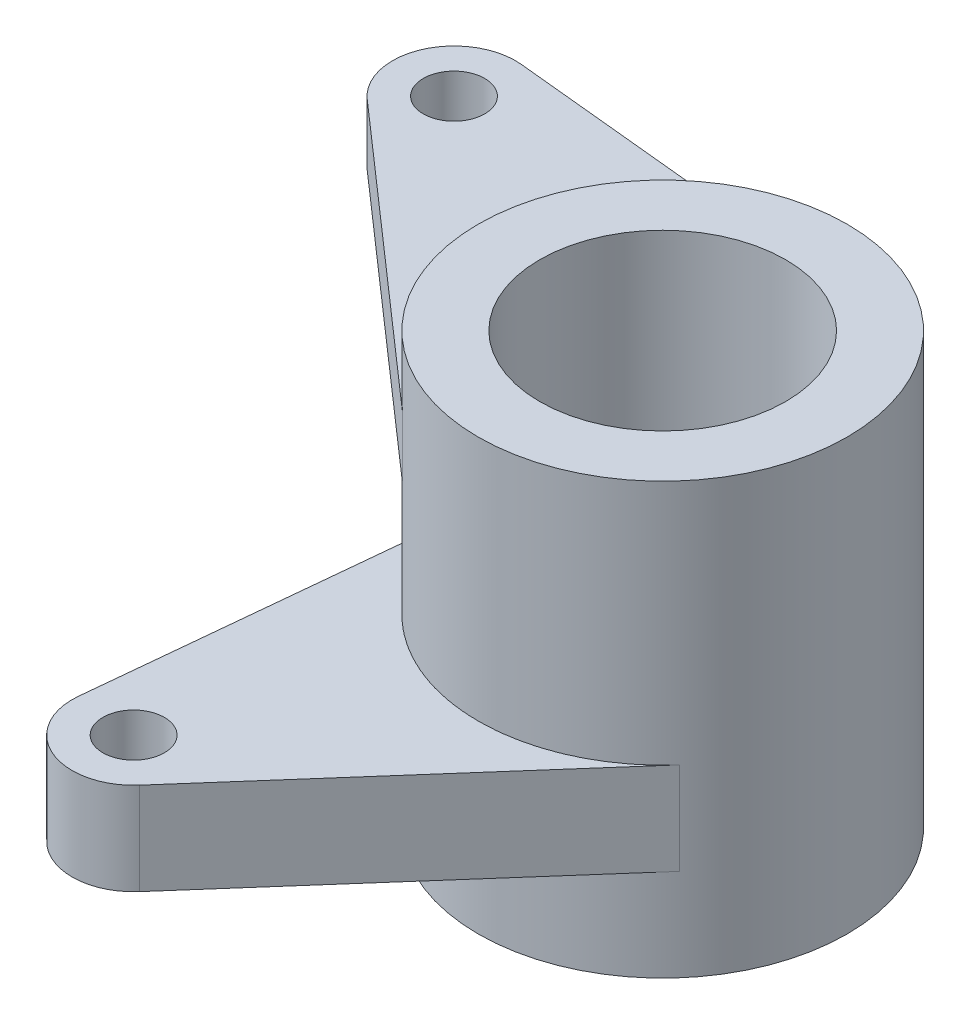
from build123d import *

# Parameters (mm, degrees)
SKETCH1_R             = 30
SKETCH1_R_2           = 20
BOSS_EXTRUDE1_DEPTH   = 70
BOSS_EXTRUDE2_START   = -10
SKETCH2_R             = 5
BOSS_EXTRUDE2_DEPTH   = 10
BOSS_EXTRUDE3_START   = -40
SKETCH2_3_R           = 5
BOSS_EXTRUDE3_DEPTH   = 15
BODY_MOVE_COPY1_ANGLE = 90


with BuildPart() as part:
    # Sketch1 → Boss-Extrude1 (new body)
    with BuildSketch(Plane(origin=(0, 0, 0), x_dir=(1, 0, 0), z_dir=(0, 1, 0))):
        Circle(SKETCH1_R)
        Circle(SKETCH1_R_2, mode=Mode.SUBTRACT)
    extrude(amount=-BOSS_EXTRUDE1_DEPTH)

    # Sketch2 → Boss-Extrude2 (add)
    with BuildSketch(Plane(origin=(0, 0, 0), x_dir=(1, 0, 0), z_dir=(0, 1, 0)).offset(BOSS_EXTRUDE2_START)):
        with BuildLine():
            Line((2.964427425, 29.853176884), (-59.011857525, 36.007436429))
            ThreePointArc((-59.011857525, 36.007436429), (-69.172409079, 30.039706689), (-66.597015029, 18.541100181))
            Line((-66.597015029, 18.541100181), (-19.791045088, -22.545831861))
            ThreePointArc((-19.791045088, -22.545831861), (-27.517227238, 11.949987663), (2.964427425, 29.853176884))
        make_face()
        with Locations((-60, 26.056377468)):
            Circle(SKETCH2_R, mode=Mode.SUBTRACT)
    extrude(amount=-BOSS_EXTRUDE2_DEPTH)


with BuildPart() as body_2:
    # Sketch2<3> → Boss-Extrude3 (new body)
    with BuildSketch(Plane(origin=(0, 0, 0), x_dir=(1, 0, 0), z_dir=(0, 1, 0)).offset(BOSS_EXTRUDE3_START)):
        with BuildLine():
            Line((2.964427425, 29.853176884), (-59.011857525, 36.007436429))
            ThreePointArc((-59.011857525, 36.007436429), (-69.172409079, 30.039706689), (-66.597015029, 18.541100181))
            Line((-66.597015029, 18.541100181), (-19.791045088, -22.545831861))
            ThreePointArc((-19.791045088, -22.545831861), (-27.517227238, 11.949987663), (2.964427425, 29.853176884))
        make_face()
        with Locations((-60, 26.056377468)):
            Circle(SKETCH2_3_R, mode=Mode.SUBTRACT)
    extrude(amount=-BOSS_EXTRUDE3_DEPTH)


with BuildPart() as body_2_1:
    # Body-Move/Copy1: moved
    add(body_2.part.rotate(Axis((0, 0, 0), (0, 1, 0)), BODY_MOVE_COPY1_ANGLE))


solid = Compound([part.part, body_2_1.part])
